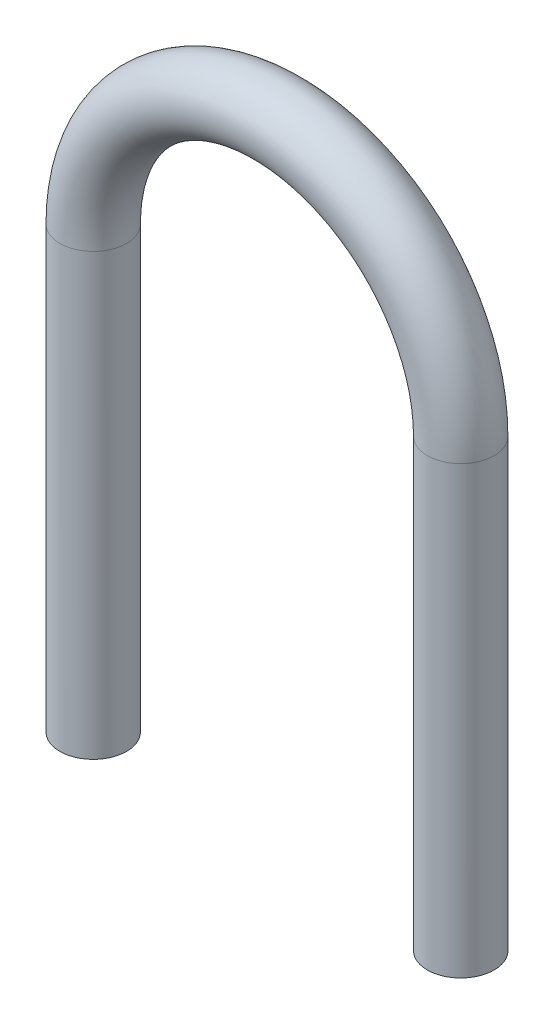
from build123d import *

# Parameters (mm, degrees)
SKETCH1_R = 3


with BuildPart() as part:
    # Sweep1: sweep along a path in Sketch2
    with BuildLine(Plane.XY) as sweep1_path:
        Line((-16.5, 0), (-16.5, 39.5))
        ThreePointArc((-16.5, 39.5), (0, 56), (16.5, 39.5))
        Line((16.5, 39.5), (16.5, -0.5))
    # Sketch1 → Sweep1 (sweep)
    with BuildSketch(Plane(origin=(0, 0, 0), x_dir=(1, 0, 0), z_dir=(0, 1, 0))):
        with Locations((-16.5, 0)):
            Circle(SKETCH1_R)
    sweep(path=sweep1_path.line)


solid = part.part
